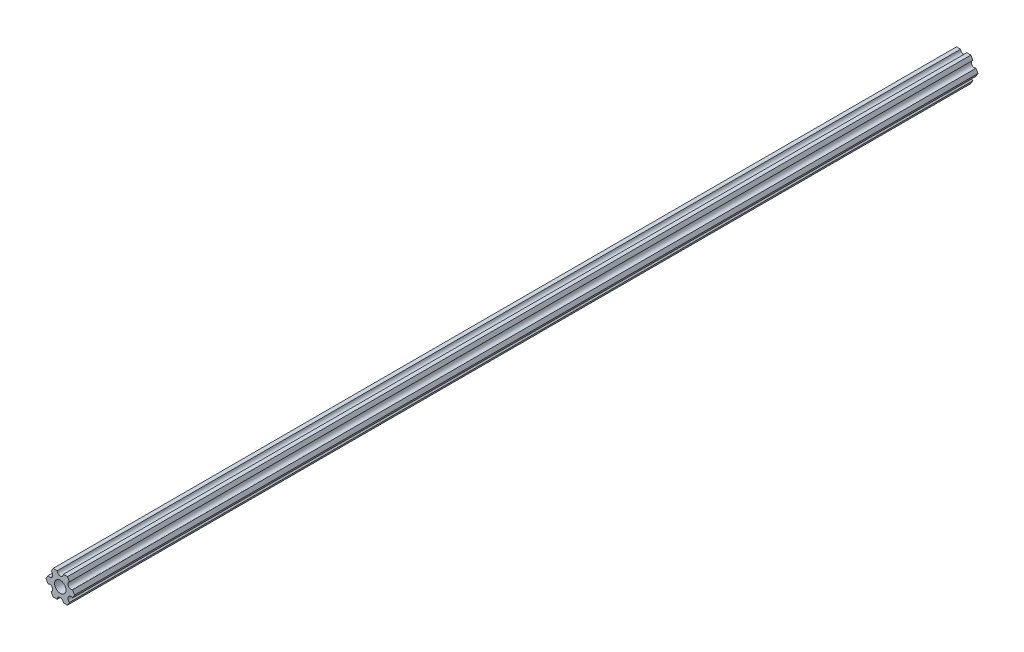
from build123d import *

# Parameters (mm, degrees)
SKETCH1_R           = 2.9337
BOSS_EXTRUDE1_DEPTH = 463.55


with BuildPart() as part:
    # Sketch1 → Boss-Extrude1 (new body)
    with BuildSketch(Plane.XY):
        with BuildLine():
            Line((-4.70551159, -4.549815043), (-3.666174521, -6.349999904))
            Line((-3.666174521, -6.349999904), (-1.587501154, -6.349999904))
            ThreePointArc((-1.587501154, -6.349999904), (-3.85e-07, -4.762499134), (1.587501154, -6.349999904))
            Line((1.587501154, -6.349999904), (3.666173825, -6.349999904))
            Line((3.666173825, -6.349999904), (4.705510929, -4.549815232))
            ThreePointArc((4.705510929, -4.549815232), (4.124445601, -2.381249904), (6.293010929, -1.800184575))
            Line((6.293010929, -1.800184575), (7.332348034, 9.6e-08))
            Line((7.332348034, 9.6e-08), (6.293011178, 1.800184715))
            ThreePointArc((6.293011178, 1.800184715), (4.124445902, 2.381250241), (4.705511428, 4.549815516))
            Line((4.705511428, 4.549815516), (3.666174521, 6.350000222))
            Line((3.666174521, 6.350000222), (1.587498846, 6.350000222))
            ThreePointArc((1.587498846, 6.350000222), (3.85e-07, 4.762501761), (-1.587498846, 6.350000222))
            Line((-1.587498846, 6.350000222), (-3.666173825, 6.350000222))
            Line((-3.666173825, 6.350000222), (-4.705511038, 4.549815614))
            ThreePointArc((-4.705511038, 4.549815614), (-4.124445841, 2.38125025), (-6.293011205, 1.800185053))
            Line((-6.293011205, 1.800185053), (-7.332348419, 4.44e-07))
            Line((-7.332348419, 4.44e-07), (-6.293011423, -1.80018429))
            ThreePointArc((-6.293011423, -1.80018429), (-4.12444613, -2.38124975), (-4.70551159, -4.549815043))
        make_face()
        with Locations(Location((0, 0, 0), (0, 0, 180))):
            Circle(SKETCH1_R, mode=Mode.SUBTRACT)
    extrude(amount=-BOSS_EXTRUDE1_DEPTH)


solid = part.part
